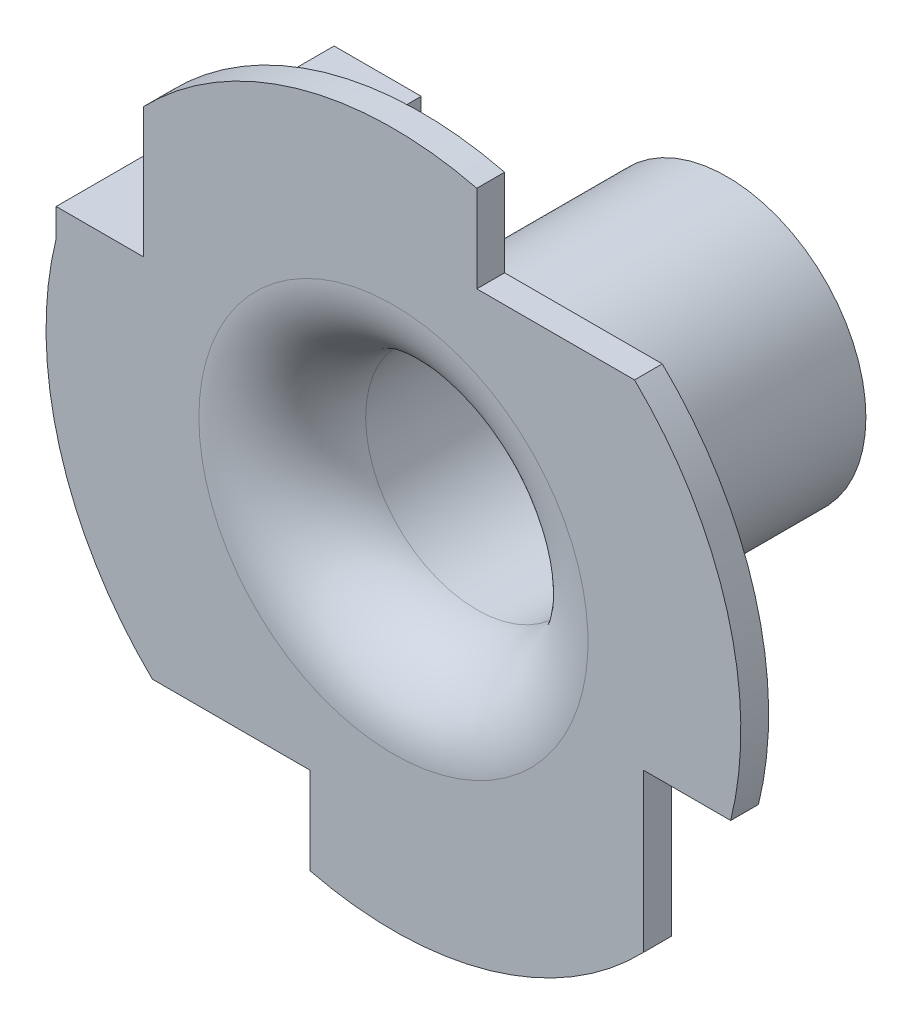
from build123d import *

# Parameters (mm, degrees)
CUT_EXTRUDE1_DEPTH       = 10
BOSS_EXTRUDE1_DEPTH      = 9
BOSS_EXTRUDE1_DEPTH_BACK = 1
SKETCH4_W                = 3.1346611
SKETCH4_H                = 1


with BuildPart() as part:
    # Sketch2 → Revolve1 (revolve)
    with BuildSketch(Plane(origin=(0, 0, 0), x_dir=(1, 0, 0), z_dir=(0, 1, 0)), mode=Mode.PRIVATE) as revolve1_sk:
        with BuildLine():
            Line((4, 11), (4, 2))
            ThreePointArc((4, 2), (4.878679656, -0.121320344), (7, -1))
            Line((7, -1), (12.5, -1))
            Line((12.5, -1), (12.5, 0))
            Line((12.5, 0), (7, 0))
            ThreePointArc((7, 0), (5.585786438, 0.585786438), (5, 2))
            Line((5, 2), (5, 11))
            Line((5, 11), (4, 11))
        make_face()
    revolve(revolve1_sk.sketch.rotate(Axis((0, 0, -90.408402744), (0, 0, 1)), 180), axis=Axis((0, 0, -90.408402744), (0, 0, 1)))

    # Sketch3 → Cut-Extrude1 (cut)
    with BuildSketch(Plane(origin=(0, 0, 0), x_dir=(-1, 0, 0), z_dir=(0, 0, -1))):
        with BuildLine():
            Line((9, 8.674675786), (9, 3))
            Line((9, 3), (12.1346611, 3))
            ThreePointArc((12.1346611, 3), (10.941616026, 6.044091225), (9, 8.674675786))
        make_face()
        with BuildLine():
            Line((8.674675786, -9), (3, -9))
            Line((3, -9), (3, -12.1346611))
            ThreePointArc((3, -12.1346611), (6.044091225, -10.941616026), (8.674675786, -9))
        make_face()
        with BuildLine():
            Line((-9, -8.674675786), (-9, -3))
            Line((-9, -3), (-12.1346611, -3))
            ThreePointArc((-12.1346611, -3), (-10.941616026, -6.044091225), (-9, -8.674675786))
        make_face()
        with BuildLine():
            Line((-8.674675786, 9), (-3, 9))
            Line((-3, 9), (-3, 12.1346611))
            ThreePointArc((-3, 12.1346611), (-6.044091225, 10.941616026), (-8.674675786, 9))
        make_face()
    extrude(amount=-CUT_EXTRUDE1_DEPTH, mode=Mode.SUBTRACT)

    # Sketch4 → Boss-Extrude1 (add, two sides: drawn at the far end of the back side and taken through both)
    with BuildSketch(Plane(origin=(0, 0, 0), x_dir=(-1, 0, 0), z_dir=(0, 0, -1)).offset(-BOSS_EXTRUDE1_DEPTH_BACK)):
        with Locations((10.56733055, 3.5)):
            Rectangle(SKETCH4_W, SKETCH4_H)
    extrude(amount=BOSS_EXTRUDE1_DEPTH + BOSS_EXTRUDE1_DEPTH_BACK)


solid = part.part
